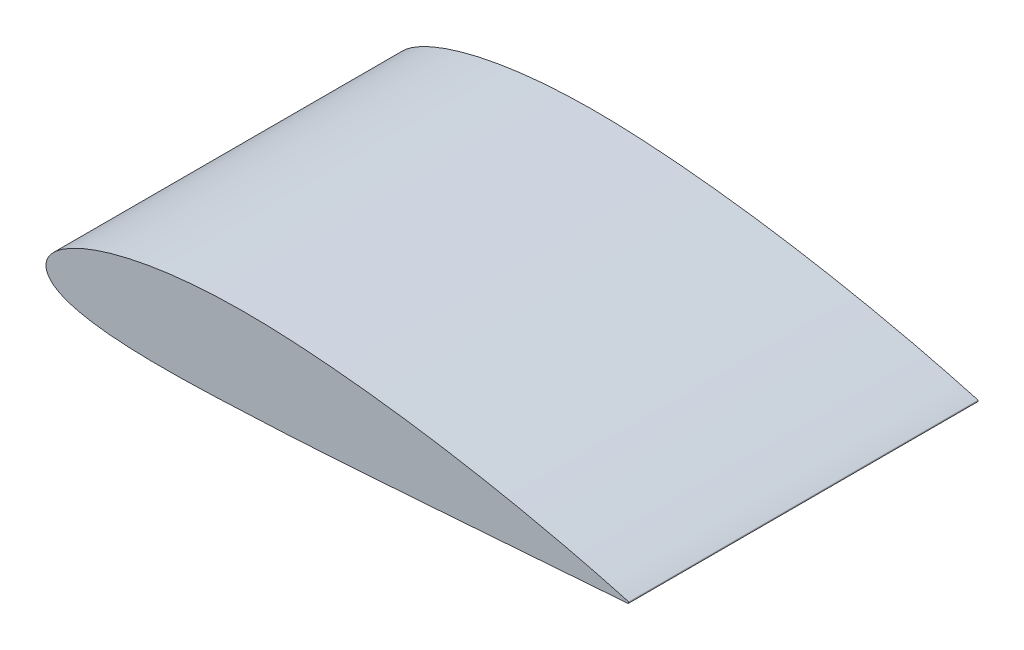
from build123d import *

# Parameters (mm, degrees)
BOSS_EXTRUDE1_DEPTH = 90


with BuildPart() as part:
    # Sketch2 → Boss-Extrude1 (new body)
    with BuildSketch(Plane.XY):
        with BuildLine():
            add(Edge.make_bspline(
                [(182.405782768, 1.479058873), (182.394349994, 1.483724256), (182.344101455, 1.494051039), (182.236733802, 1.527287474), (182.054061506, 1.575636608), (181.800427645, 1.646728658), (181.473867299, 1.735993495), (181.075691758, 1.84544027), (180.605776405, 1.973469995), (180.064742529, 2.120607691), (179.452928079, 2.285556566), (178.770992549, 2.468565644), (178.019548809, 2.668771984), (177.199129769, 2.885364173), (176.310605644, 3.1183376), (175.354600184, 3.366419879), (174.332087201, 3.629332146), (173.244022101, 3.906154364), (172.091272621, 4.19600299), (170.874985692, 4.498415089), (169.59611124, 4.812031483), (168.255990609, 5.136730882), (166.855735715, 5.470937367), (165.396693919, 5.814360546), (163.880180353, 6.165793264), (162.307605326, 6.524543339), (160.680390361, 6.889362444), (159.000134792, 7.259741153), (157.26831006, 7.634425566), (155.486600614, 8.012617365), (153.656704996, 8.393408968), (151.780349398, 8.775980907), (149.859255684, 9.159041613), (147.895334813, 9.542195913), (145.890404276, 9.924129462), (143.846373091, 10.3039729), (141.765319372, 10.681207984), (139.649198882, 11.054371574), (137.500025554, 11.422618275), (135.319921643, 11.785528638), (133.110982904, 12.141892228), (130.875399053, 12.490682573), (128.615391046, 12.831174427), (126.3331374, 13.162723672), (124.030878823, 13.484071422), (121.71095601, 13.794642685), (119.375684344, 14.093728378), (117.0273637, 14.380086686), (114.668319434, 14.653094752), (112.301035139, 14.912282601), (109.927737111, 15.156256099), (107.550965608, 15.385056126), (105.173031683, 15.597119409), (102.796452217, 15.792408994), (100.423600802, 15.97002074), (98.056917725, 16.129136883), (95.698819504, 16.269392506), (93.344958651, 16.390861187), (90.992860028, 16.49139345), (88.644689448, 16.562898483), (86.309931221, 16.606654932), (83.995859628, 16.621992281), (81.705082235, 16.608425744), (79.440192454, 16.566637898), (77.203690088, 16.496223445), (74.99814343, 16.39724422), (72.825946542, 16.270816873), (70.689634342, 16.116010343), (68.59145314, 15.934561961), (66.533899847, 15.725920784), (64.519183974, 15.491514587), (62.54962647, 15.231424283), (60.627312946, 14.946845153), (58.754400618, 14.638264722), (56.932988052, 14.306960142), (55.164951699, 13.953925512), (53.452336047, 13.579760432), (51.79680733, 13.186108056), (50.200216884, 12.773705628), (48.664174522, 12.344040691), (47.190292187, 11.898111259), (45.780077327, 11.437352093), (44.434850372, 10.963115858), (43.155884345, 10.476672742), (41.944525925, 9.979058089), (40.801808615, 9.471940954), (39.728814118, 8.956374112), (38.726439963, 8.433686011), (37.795433802, 7.905179842), (36.936775466, 7.37175408), (36.150771615, 6.835024253), (35.438397728, 6.29550465), (34.799726278, 5.754690051), (34.235742088, 5.212800331), (33.745953428, 4.671438628), (33.331331255, 4.130548341), (32.991848498, 3.590989126), (32.727738117, 3.053152843), (32.539837012, 2.51729598), (32.427854564, 1.98407531), (32.393225168, 1.453973142), (32.434771819, 0.930316799), (32.550728737, 0.418010144), (32.741087457, -0.077678934), (33.004398971, -0.554000675), (33.339962282, -1.010597961), (33.74654296, -1.447604952), (34.223192033, -1.865251656), (34.769234451, -2.263524378), (35.383836089, -2.642736281), (36.066269784, -3.002902234), (36.815561387, -3.344448124), (37.631155068, -3.666684397), (38.511797832, -3.970444936), (39.45672564, -4.255044345), (40.464777187, -4.520898307), (41.534822575, -4.768192331), (42.665954812, -4.996259941), (43.85666071, -5.206270187), (45.105947587, -5.397452118), (46.412411829, -5.570214711), (47.774760787, -5.725312067), (49.191705878, -5.862091937), (50.661782103, -5.981415853), (52.183634682, -6.083268958), (53.75577709, -6.168680251), (55.376872275, -6.237014787), (57.045368868, -6.289890385), (58.759761022, -6.326830171), (60.518531127, -6.349007354), (62.320090546, -6.356770856), (64.162942054, -6.351109249), (66.045439089, -6.332233714), (67.965983189, -6.301009728), (69.922927443, -6.258289666), (71.914587333, -6.205210175), (73.939291696, -6.141760673), (75.995364521, -6.069546949), (78.081111328, -5.989415674), (80.194715809, -5.901741003), (82.334397687, -5.807799291), (84.498356348, -5.708428815), (86.684786037, -5.604402274), (88.891821594, -5.497217554), (91.122193475, -5.386194505), (93.380937329, -5.274885841), (95.665603324, -5.155705576), (97.969296149, -5.028559052), (100.28293603, -4.894998599), (102.604336777, -4.75506421), (104.931289236, -4.610054029), (107.261616831, -4.460244927), (109.593110047, -4.30677528), (111.923457066, -4.14938214), (114.250493814, -3.989811182), (116.571896277, -3.827593038), (118.885459207, -3.663856124), (121.188975693, -3.499067075), (123.480155148, -3.333782411), (125.756831969, -3.168164685), (128.016659727, -3.002693754), (130.257517619, -2.838145871), (132.477070062, -2.674415863), (134.673201756, -2.512209356), (136.843681591, -2.351436677), (138.986384511, -2.192718436), (141.099168581, -2.036398146), (143.179855371, -1.882278136), (145.226420999, -1.730849262), (147.236750957, -1.582150522), (149.208856383, -1.436519039), (151.140655075, -1.294286239), (153.030192457, -1.154849857), (154.875543452, -1.019268208), (156.6747834, -0.886762567), (158.426142878, -0.758422201), (160.127749643, -0.633402544), (161.777845477, -0.512314269), (163.37467815, -0.395266255), (164.916632103, -0.282137449), (166.40208991, -0.173365532), (167.829445212, -0.068322512), (169.197218486, 0.031988948), (170.503959777, 0.128108777), (171.748287502, 0.219742687), (172.928858393, 0.306707433), (174.044466763, 0.389036498), (175.093851344, 0.46678931), (176.075925967, 0.5396368), (176.989567594, 0.607172448), (177.833807521, 0.670226401), (178.607763768, 0.727840711), (179.310607994, 0.780246384), (179.941538554, 0.827443732), (180.499910824, 0.869238086), (180.985098553, 0.905500301), (181.396454012, 0.936746093), (181.73378318, 0.96152939), (181.996190143, 0.982403012), (182.184646911, 0.994514217), (182.296378717, 1.006172264), (182.507969909, 1.008289756), (182.548488653, 1.420824737), (182.405782768, 1.479058873)],
                knots=[0, 0, 0, 0, 0.000122232, 0.000487865, 0.001096769, 0.001949074, 0.003042861, 0.004377197, 0.005951696, 0.007763302, 0.009811507, 0.012093257, 0.014606648, 0.017348724, 0.020317374, 0.023509526, 0.026921429, 0.030550148, 0.034391235, 0.038441892, 0.042697572, 0.047153615, 0.051806435, 0.056650335, 0.061681396, 0.0668943, 0.072283631, 0.077844204, 0.08357063, 0.089457171, 0.095497626, 0.101686279, 0.108017336, 0.114483782, 0.121079855, 0.12779895, 0.134634091, 0.141578529, 0.148625236, 0.15576784, 0.162999261, 0.170311489, 0.177697645, 0.185150866, 0.192663686, 0.200227847, 0.207836547, 0.215482404, 0.223156749, 0.230853392, 0.238563605, 0.246280342, 0.253995909, 0.261702348, 0.269392127, 0.277058237, 0.284692328, 0.292287498, 0.299902511, 0.307509761, 0.315056462, 0.32253497, 0.329938173, 0.337258997, 0.344489933, 0.351624953, 0.358656541, 0.36557831, 0.372384176, 0.379067784, 0.385622108, 0.392042229, 0.398322121, 0.404455855, 0.410438811, 0.416264476, 0.421929428, 0.427428463, 0.432756631, 0.437910804, 0.442886519, 0.447680187, 0.452288761, 0.456709932, 0.460941108, 0.46497999, 0.468825341, 0.472477126, 0.475934625, 0.479198966, 0.482271843, 0.485156203, 0.487856334, 0.490378516, 0.492731261, 0.494925426, 0.496975705, 0.498899901, 0.500720667, 0.502465213, 0.50416438, 0.505851717, 0.507539074, 0.509237793, 0.510980919, 0.512798414, 0.514716148, 0.516754845, 0.518931445, 0.521259199, 0.523748296, 0.526405583, 0.52923645, 0.532244612, 0.535431872, 0.538799073, 0.54234718, 0.546074806, 0.549981608, 0.554064834, 0.558323172, 0.562753613, 0.567353631, 0.572119754, 0.577048268, 0.582136329, 0.587379392, 0.592773901, 0.598315609, 0.603999263, 0.609821442, 0.615776709, 0.621860525, 0.628067807, 0.634393403, 0.640832102, 0.647378201, 0.654026863, 0.660772267, 0.667608603, 0.67452998, 0.681530504, 0.688604264, 0.695745312, 0.702946792, 0.710248291, 0.717664119, 0.725120353, 0.732610152, 0.740125742, 0.747660709, 0.75520723, 0.76275841, 0.770306955, 0.777844924, 0.78536553, 0.792861368, 0.800324578, 0.807748781, 0.815125698, 0.822448945, 0.829710174, 0.836903069, 0.844019795, 0.851053553, 0.857997477, 0.864844247, 0.871587101, 0.878219205, 0.884734242, 0.891124897, 0.897385336, 0.903508348, 0.909488512, 0.9153191, 0.920994209, 0.926508595, 0.931855906, 0.93703031, 0.942026976, 0.946841037, 0.951466245, 0.955898634, 0.960133404, 0.964165691, 0.967991594, 0.971606764, 0.97500782, 0.978190343, 0.981151401, 0.983887198, 0.986395695, 0.988673513, 0.990718234, 0.992527891, 0.994100552, 0.995433801, 0.996526602, 0.997378059, 0.997987099, 0.998352344, 0.998474277, 1, 1, 1, 1], degree=3))
        make_face()
    extrude(amount=BOSS_EXTRUDE1_DEPTH)


solid = part.part
